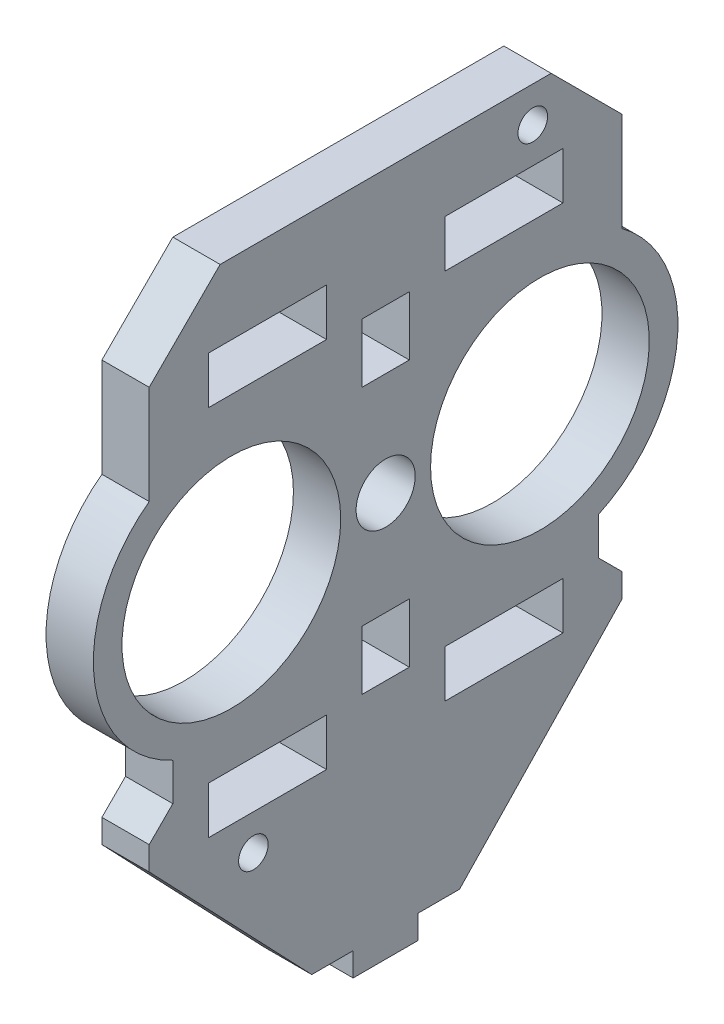
from build123d import *

# Parameters (mm, degrees)
SKETCH1_R           = 2.5
SKETCH1_R_2         = 18.5
SKETCH1_R_3         = 5
BOSS_EXTRUDE1_DEPTH = 8
CUT_EXTRUDE1_REACH  = 86.69
SKETCH2_W           = 20
SKETCH2_H           = 8
SKETCH2_W_2         = 8
SKETCH2_H_2         = 10
SKETCH2_W_3         = 7
SKETCH2_H_3         = 4


with BuildPart() as part:
    # Sketch1 → Boss-Extrude1 (new body)
    with BuildSketch(Plane(origin=(0, 0, 0), x_dir=(0, 0, -1), z_dir=(1, 0, 0))):
        with BuildLine():
            Line((-12.5, -64.29), (-40, -35.5))
            Line((-40, -35.5), (-40, -31.5))
            Line((-40, -31.5), (-36, -27.5))
            Line((-36, -27.5), (-36, -21.143055078))
            ThreePointArc((-36, -21.143055078), (-49.329627244, -2.32877567), (-40, 18.757099403))
            Line((-40, 18.757099403), (-40, 35.5))
            Line((-40, 35.5), (-28, 47.5))
            Line((-28, 47.5), (28, 47.5))
            Line((28, 47.5), (40, 35.5))
            Line((40, 35.5), (40, 18.757099403))
            ThreePointArc((40, 18.757099403), (49.329627244, -2.32877567), (36, -21.143055078))
            Line((36, -21.143055078), (36, -27.5))
            Line((36, -27.5), (40, -31.5))
            Line((40, -31.5), (40, -35.5))
            Line((40, -35.5), (12.5, -64.29))
            Line((12.5, -64.29), (12.5, -68.29))
            Line((12.5, -68.29), (-12.5, -68.29))
            Line((-12.5, -68.29), (-12.5, -64.29))
        make_face()
        with Locations((-22.373880505, -41.5)):
            Circle(SKETCH1_R, mode=Mode.SUBTRACT)
        with Locations((24.891578032, 41.5)):
            Circle(SKETCH1_R, mode=Mode.SUBTRACT)
        with Locations((-26.1, 0)):
            Circle(SKETCH1_R_2, mode=Mode.SUBTRACT)
        with Locations(Location((26.1, 0, 0), (0, 0, 180))):
            Circle(SKETCH1_R_2, mode=Mode.SUBTRACT)
        Circle(SKETCH1_R_3, mode=Mode.SUBTRACT)
    extrude(amount=BOSS_EXTRUDE1_DEPTH)

    # Sketch2 → Cut-Extrude1 (cut, up to next)
    with BuildSketch(Plane.ZY, mode=Mode.PRIVATE) as cut_extrude1_sk1:
        with Locations((20, -31.5)):
            Rectangle(SKETCH2_W, SKETCH2_H)
    cut_extrude1_tool1 = extrude(cut_extrude1_sk1.sketch, amount=-CUT_EXTRUDE1_REACH, mode=Mode.PRIVATE) & part.part
    # Sketch2 → Cut-Extrude1 (cut, up to next)
    with BuildSketch(Plane.ZY, mode=Mode.PRIVATE) as cut_extrude1_sk2:
        with Locations((-20, -31.5)):
            Rectangle(SKETCH2_W, SKETCH2_H)
    cut_extrude1_tool2 = extrude(cut_extrude1_sk2.sketch, amount=-CUT_EXTRUDE1_REACH, mode=Mode.PRIVATE) & part.part
    # Sketch2 → Cut-Extrude1 (cut, up to next)
    with BuildSketch(Plane.ZY, mode=Mode.PRIVATE) as cut_extrude1_sk3:
        with Locations((20, 31.5)):
            Rectangle(SKETCH2_W, SKETCH2_H)
    cut_extrude1_tool3 = extrude(cut_extrude1_sk3.sketch, amount=-CUT_EXTRUDE1_REACH, mode=Mode.PRIVATE) & part.part
    # Sketch2 → Cut-Extrude1 (cut, up to next)
    with BuildSketch(Plane.ZY, mode=Mode.PRIVATE) as cut_extrude1_sk4:
        with Locations((-20, 31.5)):
            Rectangle(SKETCH2_W, SKETCH2_H)
    cut_extrude1_tool4 = extrude(cut_extrude1_sk4.sketch, amount=-CUT_EXTRUDE1_REACH, mode=Mode.PRIVATE) & part.part
    # Sketch2 → Cut-Extrude1 (cut, up to next)
    with BuildSketch(Plane.ZY, mode=Mode.PRIVATE) as cut_extrude1_sk5:
        with Locations((0, 22.5)):
            Rectangle(SKETCH2_W_2, SKETCH2_H_2)
    cut_extrude1_tool5 = extrude(cut_extrude1_sk5.sketch, amount=-CUT_EXTRUDE1_REACH, mode=Mode.PRIVATE) & part.part
    # Sketch2 → Cut-Extrude1 (cut, up to next)
    with BuildSketch(Plane.ZY, mode=Mode.PRIVATE) as cut_extrude1_sk6:
        with Locations((0, -22.5)):
            Rectangle(SKETCH2_W_2, SKETCH2_H_2)
    cut_extrude1_tool6 = extrude(cut_extrude1_sk6.sketch, amount=-CUT_EXTRUDE1_REACH, mode=Mode.PRIVATE) & part.part
    # Sketch2 → Cut-Extrude1 (cut, up to next)
    with BuildSketch(Plane.ZY, mode=Mode.PRIVATE) as cut_extrude1_sk7:
        with Locations((9, -66.29)):
            Rectangle(SKETCH2_W_3, SKETCH2_H_3)
    cut_extrude1_tool7 = extrude(cut_extrude1_sk7.sketch, amount=-CUT_EXTRUDE1_REACH, mode=Mode.PRIVATE) & part.part
    # Sketch2 → Cut-Extrude1 (cut, up to next)
    with BuildSketch(Plane.ZY, mode=Mode.PRIVATE) as cut_extrude1_sk8:
        with Locations((-9, -66.29)):
            Rectangle(SKETCH2_W_3, SKETCH2_H_3)
    cut_extrude1_tool8 = extrude(cut_extrude1_sk8.sketch, amount=-CUT_EXTRUDE1_REACH, mode=Mode.PRIVATE) & part.part
    add(cut_extrude1_tool1.solids().sort_by_distance((0, -31.5, 20))[0], mode=Mode.SUBTRACT)
    add(cut_extrude1_tool2.solids().sort_by_distance((0, -31.5, -20))[0], mode=Mode.SUBTRACT)
    add(cut_extrude1_tool3.solids().sort_by_distance((0, 31.5, 20))[0], mode=Mode.SUBTRACT)
    add(cut_extrude1_tool4.solids().sort_by_distance((0, 31.5, -20))[0], mode=Mode.SUBTRACT)
    add(cut_extrude1_tool5.solids().sort_by_distance((0, 22.5, 0))[0], mode=Mode.SUBTRACT)
    add(cut_extrude1_tool6.solids().sort_by_distance((0, -22.5, 0))[0], mode=Mode.SUBTRACT)
    add(cut_extrude1_tool7.solids().sort_by_distance((0, -66.29, 9))[0], mode=Mode.SUBTRACT)
    add(cut_extrude1_tool8.solids().sort_by_distance((0, -66.29, -9))[0], mode=Mode.SUBTRACT)


solid = part.part
